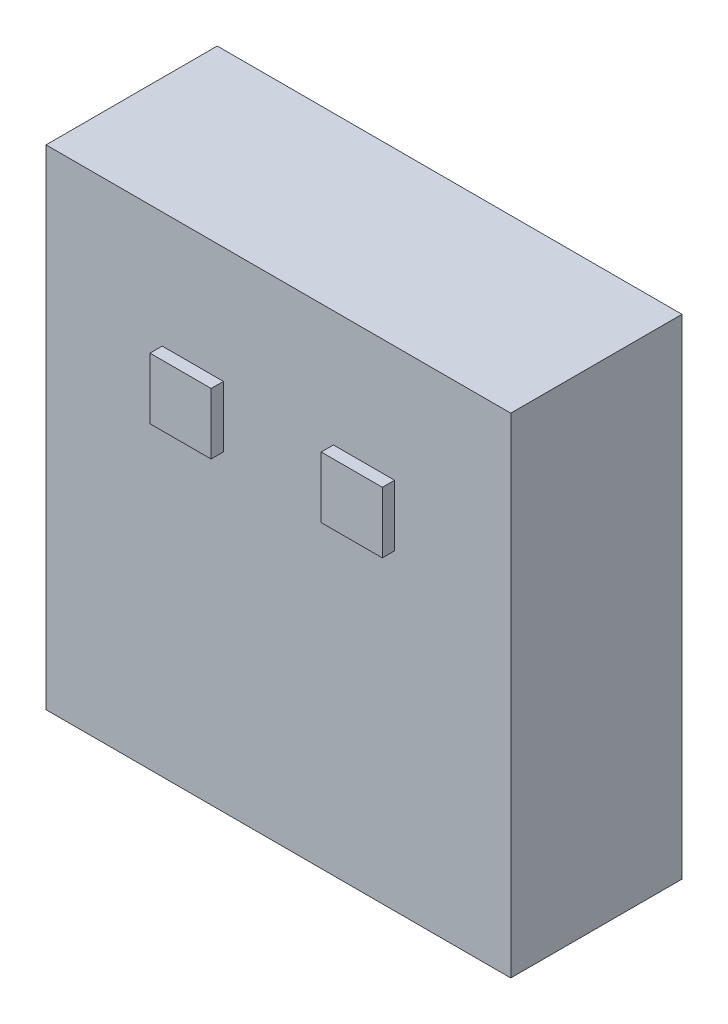
from build123d import *

# Parameters (mm, degrees)
SKETCH_1_W      = 38
SKETCH_1_H      = 40
EXTRUDE_1_DEPTH = 14
SKETCH_2_W      = 5
SKETCH_2_H      = 5
EXTRUDE_2_DEPTH = 1


with BuildPart() as part:
    # 草图1 → 凸台-拉伸1 (new body)
    with BuildSketch(Plane.XY):
        with Locations((19, 20)):
            Rectangle(SKETCH_1_W, SKETCH_1_H)
    extrude(amount=EXTRUDE_1_DEPTH)

    # 草图2 → 凸台-拉伸2 (add)
    with BuildSketch(Plane.XY.offset(14)):
        with Locations((26, 28)):
            Rectangle(SKETCH_2_W, SKETCH_2_H)
        with Locations((12, 28)):
            Rectangle(SKETCH_2_W, SKETCH_2_H)
    extrude(amount=EXTRUDE_2_DEPTH)


solid = part.part
